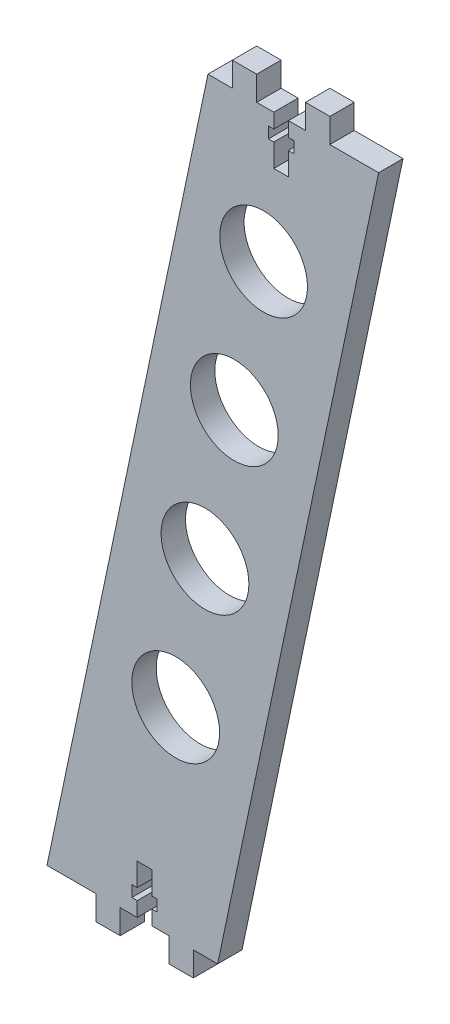
from build123d import *

# Parameters (mm, degrees)
BOSS_EXTRU_1_DEPTH      = 5
ESQUISSE2_R             = 9
ENL_V_MAT_EXTRU_1_DEPTH = 170.03549923


with BuildPart() as part:
    # Esquisse1 → Boss.-Extru.1 (new body)
    with BuildSketch(Plane.XY):
        Polygon((29.5, 154), (29.5, 157), (33, 157), (33, 162), (38, 162), (38, 157), (48, 157), (15, 0), (10, 0), (10, -5), (5, -5), (5, 0), (1.5, 0), (1.5, 3), (2.6, 3), (2.6, 5.3), (1.5, 5.3), (1.5, 10), (-1.5, 10), (-1.5, 5.3), (-2.6, 5.3), (-2.6, 3), (-1.5, 3), (-1.5, 0), (-5, 0), (-5, -5), (-10, -5), (-10, 0), (-20, 0), (13, 157), (18, 157), (18, 162), (23, 162), (23, 157), (26.5, 157), (26.5, 154), (25.4, 154), (25.4, 151.7), (26.5, 151.7), (26.5, 147), (29.5, 147), (29.5, 151.7), (30.6, 151.7), (30.6, 154), align=None)
    extrude(amount=BOSS_EXTRU_1_DEPTH)

    # Esquisse2 → Enlèv. mat.-Extru.1 (cut, through all)
    with BuildSketch(Plane.XY.offset(5)):
        with Locations((24.411695113, 129.442936805)):
            Circle(ESQUISSE2_R)
        with Locations((18.404488272, 100.050531902)):
            Circle(ESQUISSE2_R)
        with Locations((12.397281431, 70.658126999)):
            Circle(ESQUISSE2_R)
        with Locations((6.390074589, 41.265722097)):
            Circle(ESQUISSE2_R)
    extrude(amount=-ENL_V_MAT_EXTRU_1_DEPTH, mode=Mode.SUBTRACT)


solid = part.part
